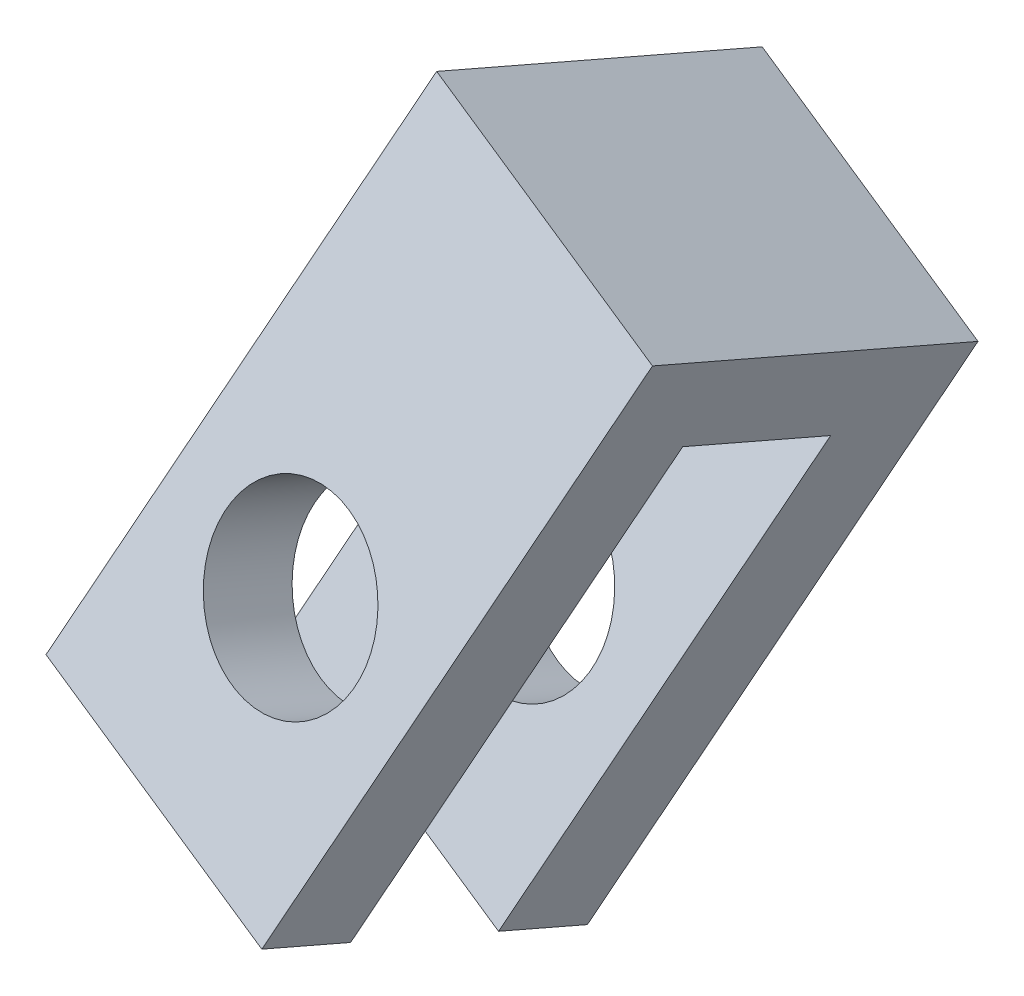
from build123d import *

# Parameters (mm, degrees)
BOSS_EXTRUDE1_DEPTH     = 10
CUT_EXTRUDE1_DEPTH      = 645.694266496
CUT_EXTRUDE1_DEPTH_BACK = 645.694266496
SKETCH3_R               = 3


with BuildPart() as part:
    # Sketch2 → Boss-Extrude1 (new body)
    with BuildSketch(Plane(origin=(707.562217201, 137.847000427, -295.175758868), x_dir=(0.354162422945148, 0.881836565444649, -0.31134105096888115), z_dir=(-0.9318848047050304, 0.30484147230294734, -0.1966275350098222))):
        Polygon((-166.545846492, -35.496085413), (-149.545846492, -35.496085413), (-149.545846492, -40.496085413), (-166.545846492, -40.496085413), (-166.545846492, -43.496085413), (-146.545846492, -43.496085413), (-146.545846492, -32.496085413), (-166.545846492, -32.496085413), align=None)
    extrude(amount=BOSS_EXTRUDE1_DEPTH)

    # Sketch3 → Cut-Extrude1 (cut, two sides: drawn at the far end of the back side and taken through both)
    with BuildSketch(Plane(origin=(18.826454002, -86.301151934, -223.021951761), x_dir=(-0.9969153981489656, -0.02832360582342947, -0.07319468755755801), z_dir=(0.07848368577920857, -0.35977207869560485, -0.9297334900161196)).offset(-CUT_EXTRUDE1_DEPTH_BACK)):
        with Locations(Location((-626.324876441, 87.720012572, 0), (0, 0, 90))):
            Circle(SKETCH3_R)
    extrude(amount=CUT_EXTRUDE1_DEPTH + CUT_EXTRUDE1_DEPTH_BACK, mode=Mode.SUBTRACT)


solid = part.part
